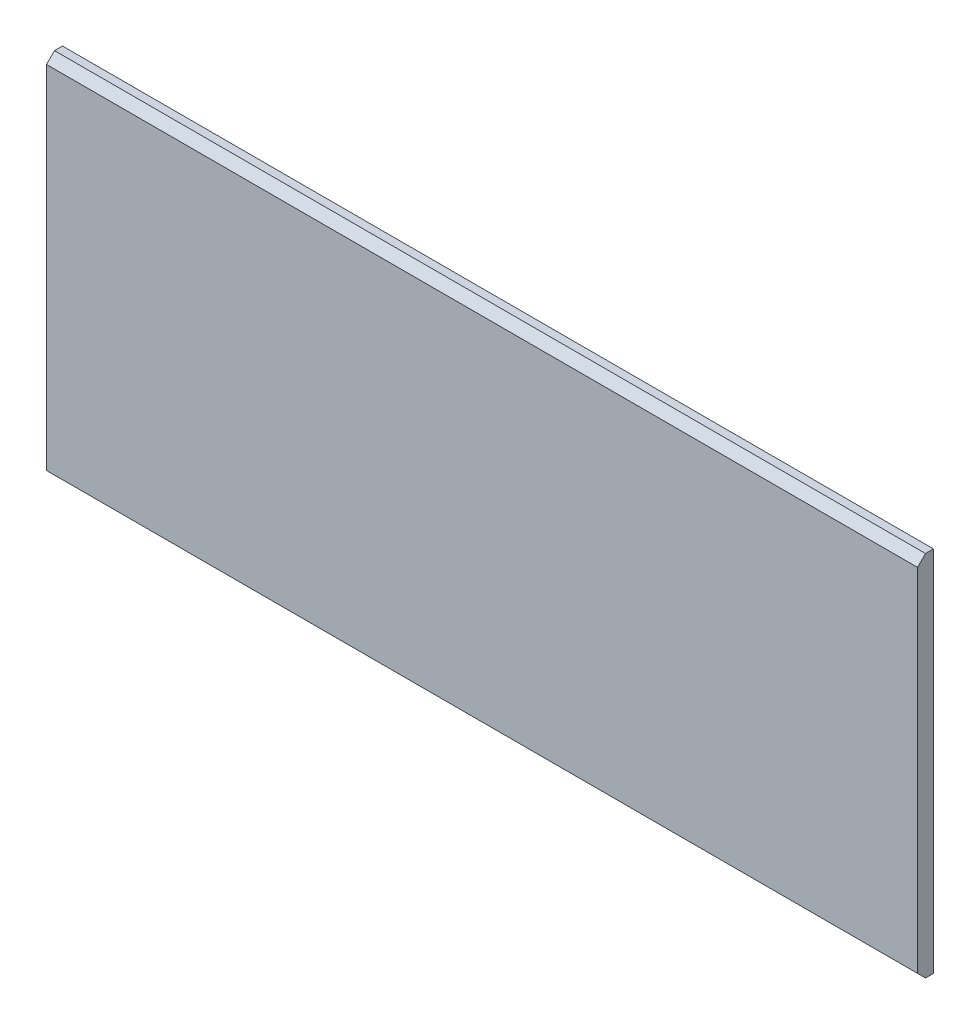
from build123d import *

# Parameters (mm, degrees)
SKETCH_1_W      = 545
SKETCH_1_H      = 230
EXTRUDE_1_DEPTH = 10
CHAMFER_1_SIZE  = 5


with BuildPart() as part:
    # 草图1 → 凸台-拉伸1 (new body)
    with BuildSketch(Plane.XY):
        Rectangle(SKETCH_1_W, SKETCH_1_H)
    extrude(amount=EXTRUDE_1_DEPTH)

    # 倒角1
    chamfer_1_edges = [part.edges().sort_by_distance(p)[0] for p in [
        (0, -115, 10),
        (0, 115, 10),
    ]]
    chamfer(chamfer_1_edges, length=CHAMFER_1_SIZE)


solid = part.part
